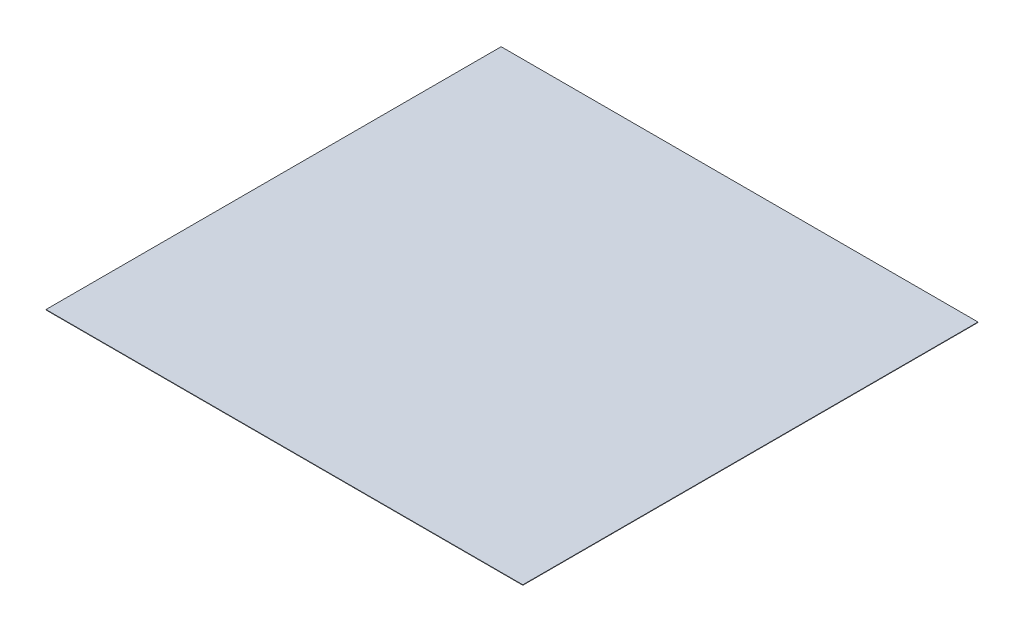
from build123d import *

# Parameters (mm, degrees)
SKETCH1_W           = 220
SKETCH1_H           = 210
BOSS_EXTRUDE1_DEPTH = 0.2


with BuildPart() as part:
    # Sketch1 → Boss-Extrude1 (new body)
    with BuildSketch(Plane(origin=(0, 0, 0), x_dir=(1, 0, 0), z_dir=(0, 1, 0))):
        Rectangle(SKETCH1_W, SKETCH1_H)
    extrude(amount=BOSS_EXTRUDE1_DEPTH)


solid = part.part
